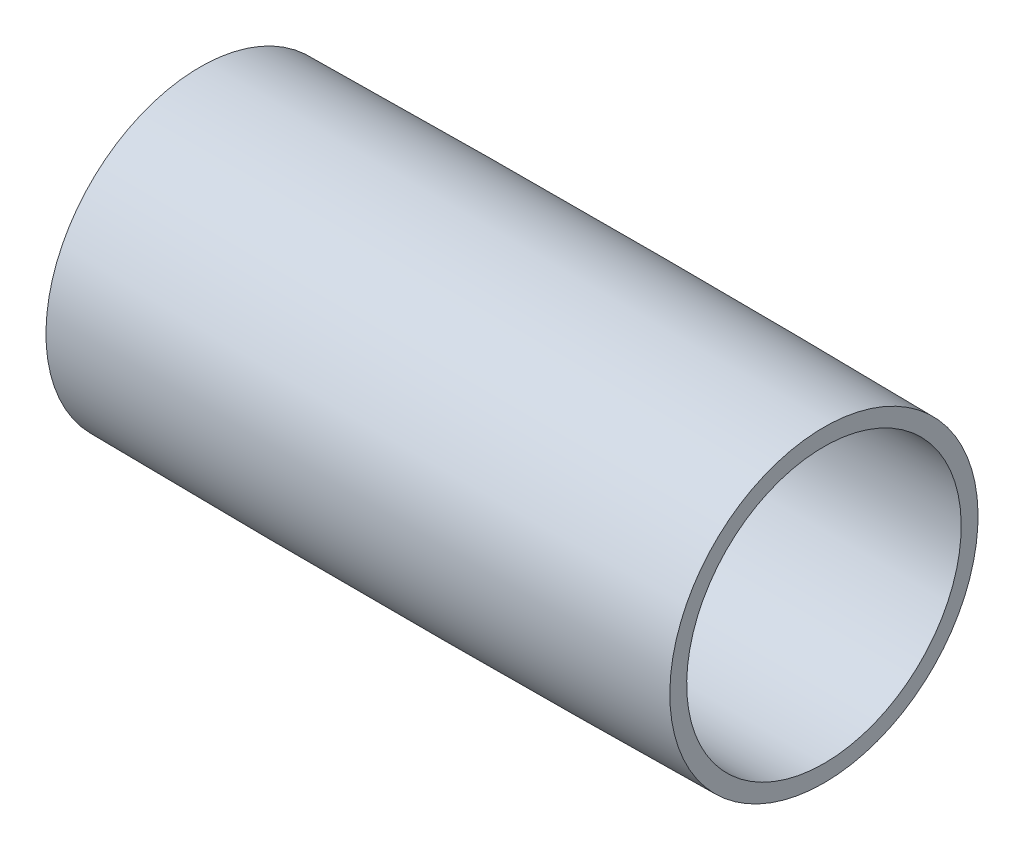
from build123d import *

# Parameters (mm, degrees)
SKETCH1_W = 100
SKETCH1_H = 3


with BuildPart() as part:
    # Sketch1 → Revolve1 (revolve)
    with BuildSketch(Plane.XY, mode=Mode.PRIVATE) as revolve1_sk:
        with Locations((50, 23.5)):
            Rectangle(SKETCH1_W, SKETCH1_H)
    revolve(revolve1_sk.sketch.rotate(Axis((0, 0, 0), (1, 0, 0)), 180), axis=Axis((0, 0, 0), (1, 0, 0)))

    # Sketch2 → Cut-Revolve1 (revolve, cut)
    with BuildSketch(Plane.XY):
        with BuildLine():
            Line((0, 25), (0, 24.7))
            ThreePointArc((0, 24.7), (50, 25), (100, 24.7))
            Line((100, 24.7), (100, 25))
            Line((100, 25), (100, 25.3))
            Line((100, 25.3), (0, 25.3))
            Line((0, 25.3), (0, 25))
        make_face()
    revolve(axis=Axis((0, 0, 0), (1, 0, 0)), mode=Mode.SUBTRACT)


solid = part.part
